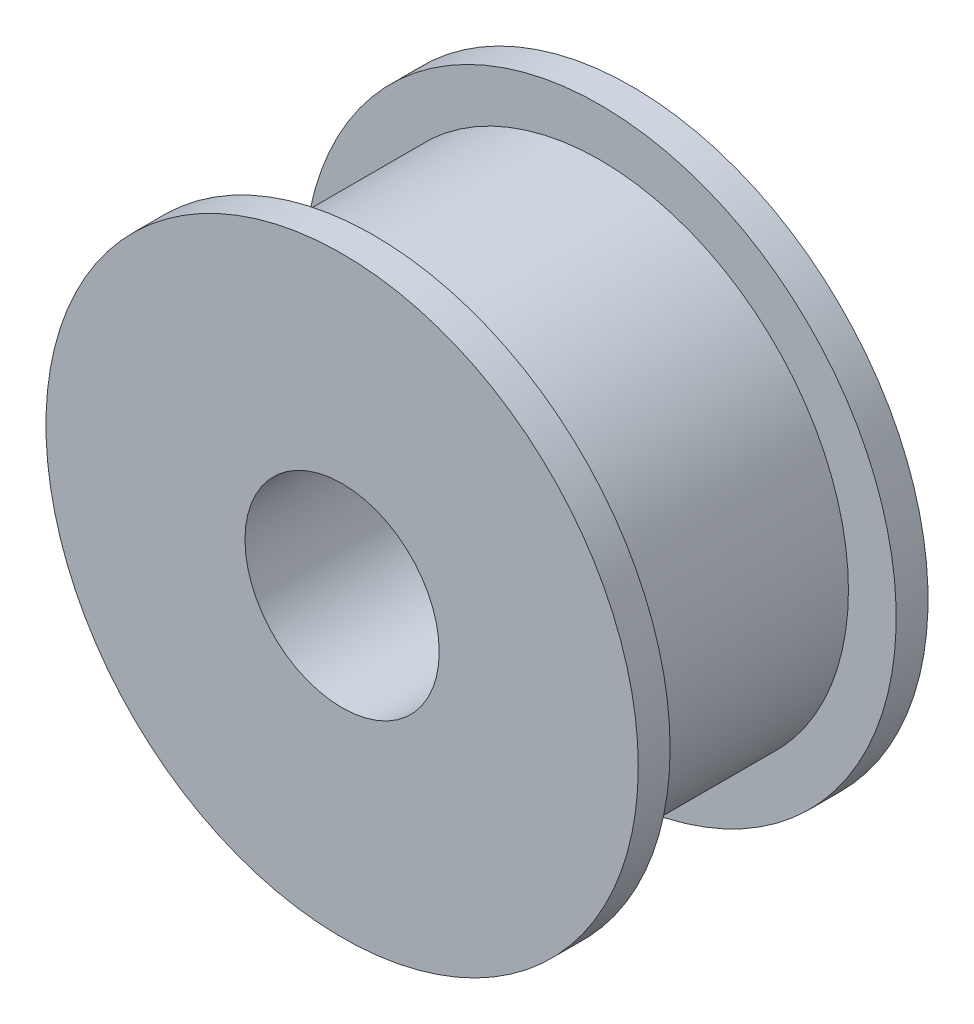
from build123d import *

# Parameters (mm, degrees)
ESBO_O1_R                = 7.8
ESBO_O1_R_2              = 3.05
RESSALTO_EXTRUS_O1_DEPTH = 9.1
ESBO_O2_R                = 9.3
ESBO_O2_R_2              = 7.8
RESSALTO_EXTRUS_O2_DEPTH = 1
RESSALTO_EXTRUS_O3_START = -1
ESBO_O3_R                = 9.3
ESBO_O3_R_2              = 7.8
RESSALTO_EXTRUS_O3_DEPTH = 1


with BuildPart() as part:
    # Esboço1 → Ressalto-extrusão1 (new body)
    with BuildSketch(Plane.XY):
        Circle(ESBO_O1_R)
        Circle(ESBO_O1_R_2, mode=Mode.SUBTRACT)
    extrude(amount=RESSALTO_EXTRUS_O1_DEPTH)

    # Esboço2 → Ressalto-extrusão2 (add)
    with BuildSketch(Plane(origin=(0, 0, 0), x_dir=(-1, 0, 0), z_dir=(0, 0, -1))):
        Circle(ESBO_O2_R)
        Circle(ESBO_O2_R_2, mode=Mode.SUBTRACT)
    extrude(amount=-RESSALTO_EXTRUS_O2_DEPTH)

    # Esboço3 → Ressalto-extrusão3 (add)
    with BuildSketch(Plane.XY.offset(9.1).offset(RESSALTO_EXTRUS_O3_START)):
        with Locations(Location((0, 0, 0), (0, 0, 180))):
            Circle(ESBO_O3_R)
        with Locations(Location((0, 0, 0), (0, 0, 180))):
            Circle(ESBO_O3_R_2, mode=Mode.SUBTRACT)
    extrude(amount=RESSALTO_EXTRUS_O3_DEPTH)


solid = part.part
